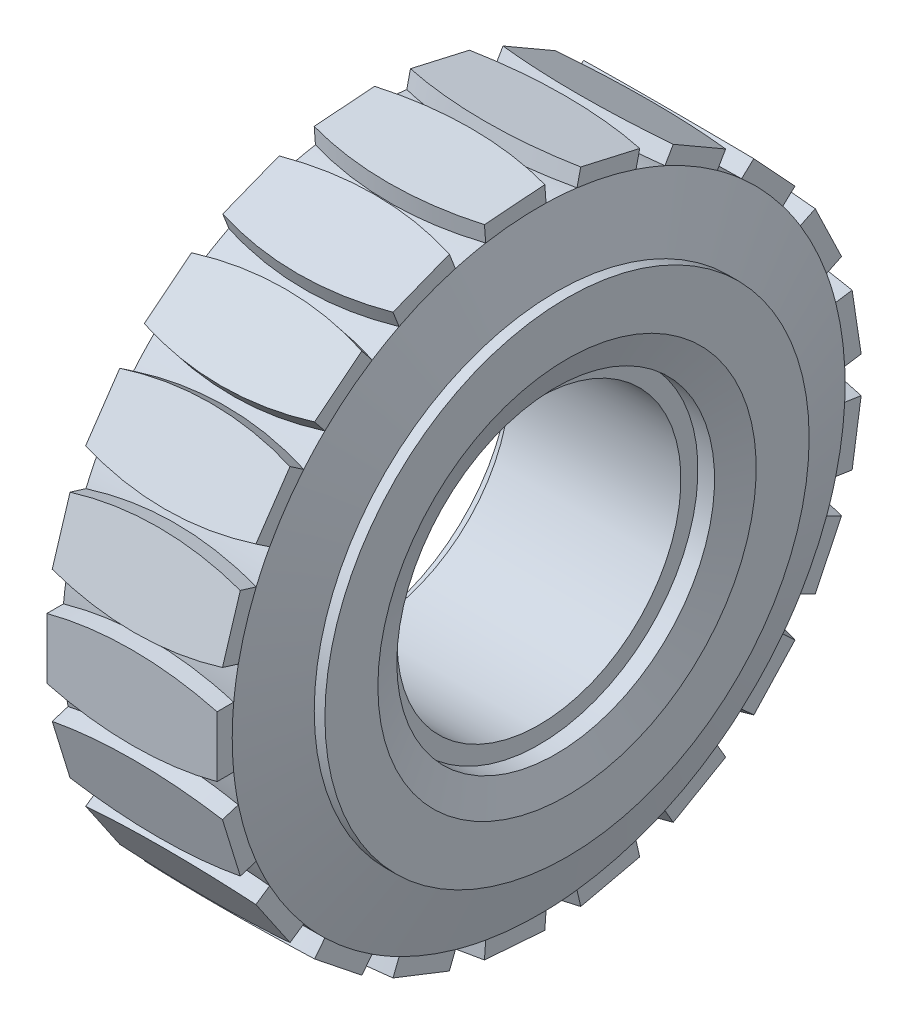
from build123d import *

# Parameters (mm, degrees)
BOSS_EXTRUDE2_START = -0.185037
BOSS_EXTRUDE2_DEPTH = 1.185037
CIRPATTERN2_COUNT   = 21


with BuildPart() as part:
    # Sketch1 → Revolve1 (revolve)
    with BuildSketch(Plane.XY, mode=Mode.PRIVATE) as revolve1_sk:
        Polygon((5.650000000000001, 9.375), (2.21e-15, 9.374999999999998), (0, 20.25), (5.625000000000002, 20.25), (6.79375, 16), (7.500000000000003, 16), (7.5000000000000036, 12.5), (6.750000000000003, 10.5), (5.650000000000002, 10.5), align=None)
    revolve(revolve1_sk.sketch.rotate(Axis((0, 0, 0), (1, 0, 0)), 90), axis=Axis((0, 0, 0), (1, 0, 0)))

    # Mirror1: part across plane


with BuildPart() as part_1:
    add(part.part)
    add(part.part.mirror(Plane(origin=(0, 0, 0), x_dir=(0, 0, 1), z_dir=(1, 0, 0))))

    # Sketch5 → Boss-Extrude2 (add)
    with BuildSketch(Plane.XY.offset(20.25).offset(BOSS_EXTRUDE2_START)):
        with BuildLine():
            Line((-5.625000000000002, 2), (-5.625000000000002, -2))
            ThreePointArc((-5.625000000000002, -2), (1.35e-15, -2.7312582647679875), (5.625000000000002, -2))
            Line((5.625000000000002, -2), (5.625000000000002, 2))
            ThreePointArc((5.625000000000002, 2), (1.35e-15, 2.7312582647679875), (-5.625000000000002, 2))
        make_face()
    boss_extrude2 = extrude(amount=BOSS_EXTRUDE2_DEPTH)

    # CirPattern2: Boss-Extrude2 ×21 about axis
    cirpattern2_axis = Axis((0, 8.9e-16, -3.9e-16), (1, 0, 0))
    for i in range(1, CIRPATTERN2_COUNT):
        add(boss_extrude2.rotate(cirpattern2_axis, i * 360 / CIRPATTERN2_COUNT))


solid = part_1.part
